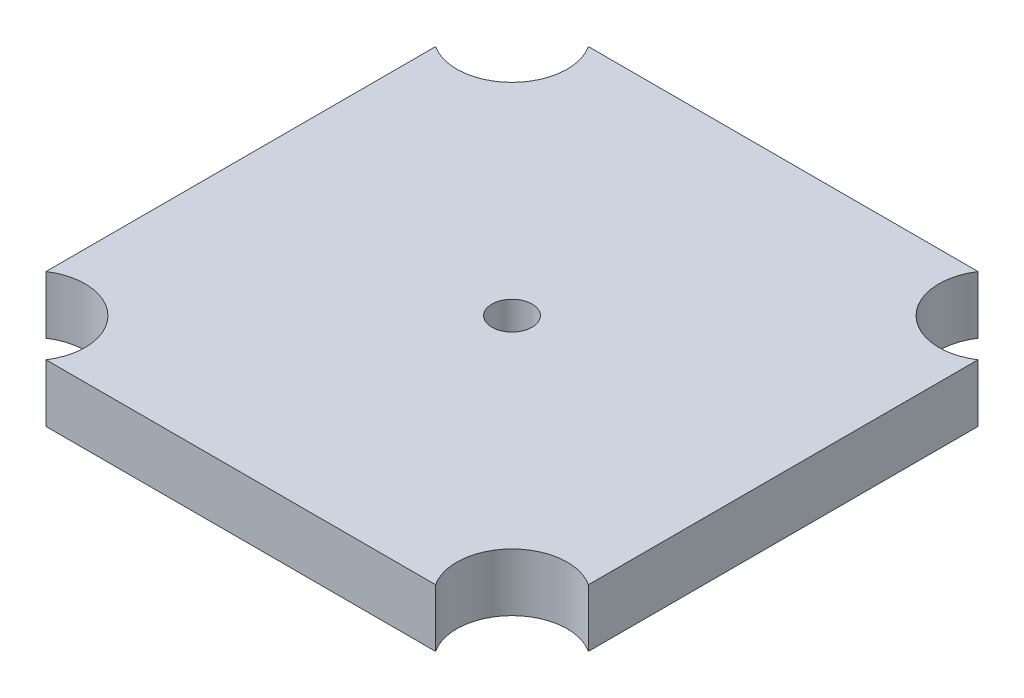
from build123d import *

# Parameters (mm, degrees)
SKETCH1_W                  = 171.45
SKETCH1_H                  = 171.45
BOSS_EXTRUDE1_DEPTH        = 18.25625
SKETCH2_R                  = 17.4625
CUT_EXTRUDE1_DEPTH         = 123.60033407
F_1_2_0_5_DIAMETER_HOLE1_D = 12.7


with BuildPart() as part:
    # Sketch1 → Boss-Extrude1 (new body)
    with BuildSketch(Plane(origin=(0, 0, 0), x_dir=(1, 0, 0), z_dir=(0, 1, 0))):
        Rectangle(SKETCH1_W, SKETCH1_H)
    extrude(amount=BOSS_EXTRUDE1_DEPTH)

    # Sketch2 → Cut-Extrude1 (cut, through all)
    with BuildSketch(Plane(origin=(0, 18.25625, 0), x_dir=(1, 0, 0), z_dir=(0, 1, 0))):
        with Locations((-76.2, 76.2)):
            Circle(SKETCH2_R)
        with Locations((76.2, 76.2)):
            Circle(SKETCH2_R)
        with Locations((76.2, -76.2)):
            Circle(SKETCH2_R)
        with Locations((-76.2, -76.2)):
            Circle(SKETCH2_R)
    extrude(amount=-CUT_EXTRUDE1_DEPTH, mode=Mode.SUBTRACT)

    # 1/2 (0.5) Diameter Hole1 (through all)
    with Locations(Plane(origin=(0, 18.25625, 0), x_dir=(1, 0, 0), z_dir=(0, 1, 0))):
        with Locations((0, 0)):
            Hole(F_1_2_0_5_DIAMETER_HOLE1_D / 2)


solid = part.part
